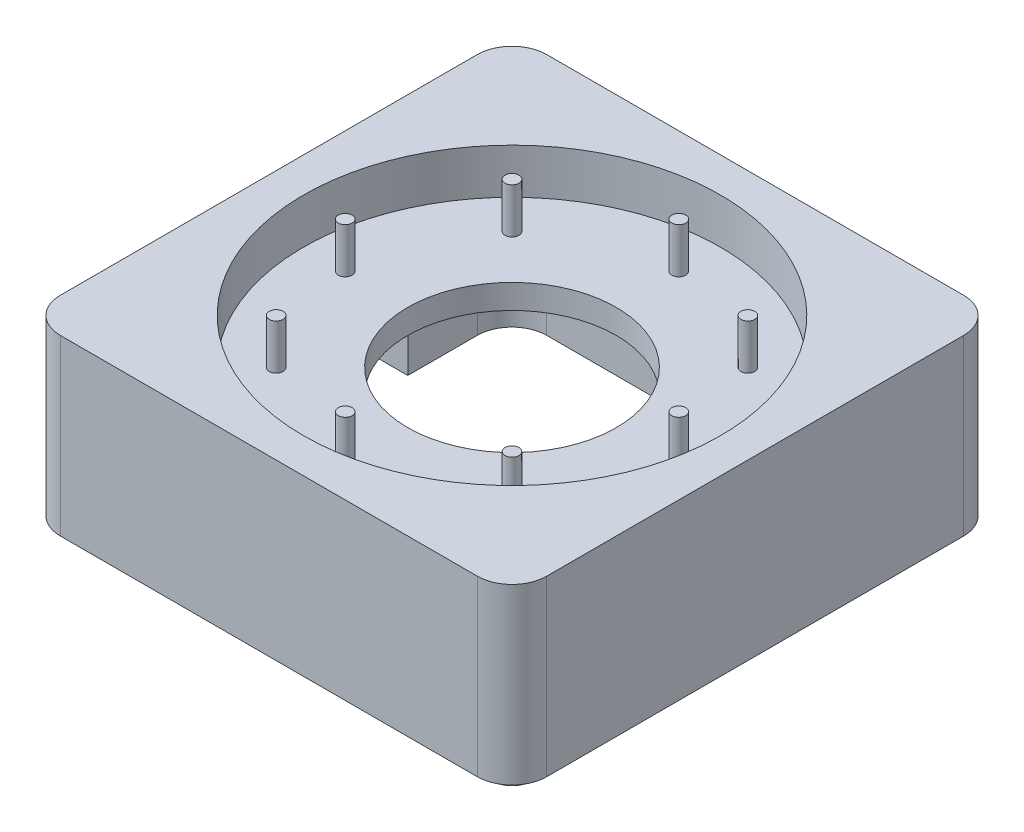
from build123d import *

# Parameters (mm, degrees)
BOSS_EXTRUDE1_DEPTH = 50
SKETCH2_R           = 60
CUT_EXTRUDE1_DEPTH  = 13
SKETCH3_R           = 10
CUT_EXTRUDE2_DEPTH  = 50
SKETCH4_R           = 2
BOSS_EXTRUDE2_DEPTH = 13
CUT_EXTRUDE3_DEPTH  = 30
SKETCH6_R           = 6
BOSS_EXTRUDE4_DEPTH = 3
SKETCH7_R           = 30
CUT_EXTRUDE4_DEPTH  = 40
CUT_EXTRUDE5_DEPTH  = 25


with BuildPart() as part:
    # Sketch1 → Boss-Extrude1 (new body)
    with BuildSketch(Plane(origin=(0, 0, 0), x_dir=(1, 0, 0), z_dir=(0, 1, 0))):
        with BuildLine():
            Line((-57.148676171, 55.458248473), (62.851323829, 55.458248473))
            ThreePointArc((62.851323829, 55.458248473), (69.922391641, 52.529316284), (72.851323829, 45.458248473))
            Line((72.851323829, 45.458248473), (72.851323829, -74.541751527))
            ThreePointArc((72.851323829, -74.541751527), (69.922391641, -81.612819339), (62.851323829, -84.541751527))
            Line((62.851323829, -84.541751527), (-57.148676171, -84.541751527))
            ThreePointArc((-57.148676171, -84.541751527), (-64.219743983, -81.612819339), (-67.148676171, -74.541751527))
            Line((-67.148676171, -74.541751527), (-67.148676171, 45.458248473))
            ThreePointArc((-67.148676171, 45.458248473), (-64.219743983, 52.529316284), (-57.148676171, 55.458248473))
        make_face()
    extrude(amount=BOSS_EXTRUDE1_DEPTH)

    # Sketch2 → Cut-Extrude1 (cut)
    with BuildSketch(Plane(origin=(0, 50, 0), x_dir=(1, 0, 0), z_dir=(0, 1, 0))):
        with Locations(Location((2.851323829, -14.541751527, 0), (0, 0, 270))):
            Circle(SKETCH2_R)
    extrude(amount=-CUT_EXTRUDE1_DEPTH, mode=Mode.SUBTRACT)

    # Sketch3 → Cut-Extrude2 (cut)
    with BuildSketch(Plane(origin=(0, 37, 0), x_dir=(1, 0, 0), z_dir=(0, 1, 0))):
        with Locations(Location((2.851323829, -14.541751527, 0), (0, 0, 270))):
            Circle(SKETCH3_R)
    extrude(amount=-CUT_EXTRUDE2_DEPTH, mode=Mode.SUBTRACT)

    # Sketch4 → Boss-Extrude2 (add)
    with BuildSketch(Plane(origin=(0, 37, 0), x_dir=(1, 0, 0), z_dir=(0, 1, 0))):
        with Locations(Location((2.851323829, 33.458248473, 0), (0, 0, 90))):
            Circle(SKETCH4_R)
        with Locations(Location((36.792449326, 19.399373969, 0), (0, 0, 90))):
            Circle(SKETCH4_R)
        with Locations(Location((50.851323829, -14.541751527, 0), (0, 0, 90))):
            Circle(SKETCH4_R)
        with Locations(Location((36.792449326, -48.482877024, 0), (0, 0, 90))):
            Circle(SKETCH4_R)
        with Locations(Location((2.851323829, -62.541751527, 0), (0, 0, 90))):
            Circle(SKETCH4_R)
        with Locations(Location((-31.089801668, -48.482877024, 0), (0, 0, 90))):
            Circle(SKETCH4_R)
        with Locations(Location((-45.148676171, -14.541751527, 0), (0, 0, 90))):
            Circle(SKETCH4_R)
        with Locations(Location((-31.089801668, 19.399373969, 0), (0, 0, 90))):
            Circle(SKETCH4_R)
    extrude(amount=BOSS_EXTRUDE2_DEPTH)

    # Sketch5 → Cut-Extrude3 (cut)
    with BuildSketch(Plane.XZ):
        with BuildLine():
            Line((-37.148676171, 64.541751527), (42.851323829, 64.541751527))
            ThreePointArc((42.851323829, 64.541751527), (49.922391641, 61.612819339), (52.851323829, 54.541751527))
            Line((52.851323829, 54.541751527), (52.851323829, -25.458248473))
            ThreePointArc((52.851323829, -25.458248473), (49.922391641, -32.529316284), (42.851323829, -35.458248473))
            Line((42.851323829, -35.458248473), (-37.148676171, -35.458248473))
            ThreePointArc((-37.148676171, -35.458248473), (-44.219743983, -32.529316284), (-47.148676171, -25.458248473))
            Line((-47.148676171, -25.458248473), (-47.148676171, 54.541751527))
            ThreePointArc((-47.148676171, 54.541751527), (-44.219743983, 61.612819339), (-37.148676171, 64.541751527))
        make_face()
    extrude(amount=-CUT_EXTRUDE3_DEPTH, mode=Mode.SUBTRACT)

    # Sketch6 → Boss-Extrude4 (add)
    with BuildSketch(Plane.XZ):
        with Locations(Location((-57.148676171, 74.541751527, 0), (0, 0, 90))):
            Circle(SKETCH6_R)
        with Locations(Location((62.851323829, 74.541751527, 0), (0, 0, 90))):
            Circle(SKETCH6_R)
        with Locations(Location((62.851323829, -45.458248473, 0), (0, 0, 90))):
            Circle(SKETCH6_R)
        with Locations(Location((-57.148676171, -45.458248473, 0), (0, 0, 90))):
            Circle(SKETCH6_R)
    extrude(amount=BOSS_EXTRUDE4_DEPTH)

    # Sketch7 → Cut-Extrude4 (cut)
    with BuildSketch(Plane(origin=(0, 37, 0), x_dir=(1, 0, 0), z_dir=(0, 1, 0))):
        with Locations(Location((2.851323829, -14.541751527, 0), (0, 0, 270))):
            Circle(SKETCH7_R)
    extrude(amount=-CUT_EXTRUDE4_DEPTH, mode=Mode.SUBTRACT)

    # Sketch8 → Cut-Extrude5 (cut)
    with BuildSketch(Plane.ZY.offset(67.148676171)):
        with BuildLine():
            Line((-5.458248473, 0), (34.541751527, 0))
            Line((34.541751527, 0), (34.541751527, 12))
            ThreePointArc((34.541751527, 12), (33.663071871, 14.121320344), (31.541751527, 15))
            Line((31.541751527, 15), (-2.458248473, 15))
            ThreePointArc((-2.458248473, 15), (-4.579568816, 14.121320344), (-5.458248473, 12))
            Line((-5.458248473, 12), (-5.458248473, 0))
        make_face()
    extrude(amount=-CUT_EXTRUDE5_DEPTH, mode=Mode.SUBTRACT)


solid = part.part
